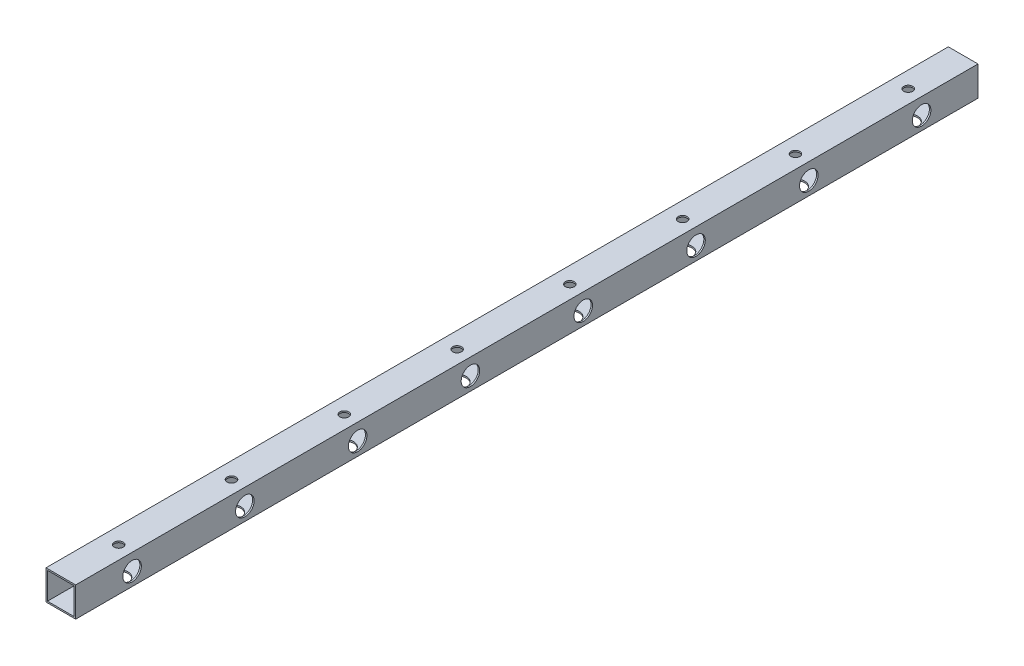
from build123d import *

# Parameters (mm, degrees)
SKETCH1_W           = 40
SKETCH1_H           = 40
SKETCH1_W_2         = 36
SKETCH1_H_2         = 36
EXTRUDE_THIN1_DEPTH = 1216
SKETCH4_R           = 12.5
CUT_EXTRUDE2_DEPTH  = 10
SKETCH5_R           = 12.5
CUT_EXTRUDE3_DEPTH  = 10
SKETCH6_R           = 6
CUT_EXTRUDE4_DEPTH  = 10
SKETCH7_R           = 6
CUT_EXTRUDE5_DEPTH  = 10
LPATTERN2_COUNT     = 8
LPATTERN2_PITCH     = 152


with BuildPart() as part:
    # Sketch1 → Extrude-Thin1 (new body)
    with BuildSketch(Plane.XY):
        Rectangle(SKETCH1_W, SKETCH1_H)
        Rectangle(SKETCH1_W_2, SKETCH1_H_2, mode=Mode.SUBTRACT)
    extrude(amount=EXTRUDE_THIN1_DEPTH)

    # Sketch4 → Cut-Extrude2 (cut)
    with BuildSketch(Plane(origin=(20, 0, 0), x_dir=(0, 0, -1), z_dir=(1, 0, 0))):
        with Locations((-1140, -2)):
            Circle(SKETCH4_R)
    cut_extrude2 = extrude(amount=-CUT_EXTRUDE2_DEPTH, mode=Mode.SUBTRACT)

    # Sketch5 → Cut-Extrude3 (cut)
    with BuildSketch(Plane.XZ.offset(20)):
        with Locations((2, 1140)):
            Circle(SKETCH5_R)
    cut_extrude3 = extrude(amount=-CUT_EXTRUDE3_DEPTH, mode=Mode.SUBTRACT)

    # Sketch6 → Cut-Extrude4 (cut)
    with BuildSketch(Plane(origin=(-18, 0, 0), x_dir=(0, 0, -1), z_dir=(1, 0, 0))):
        with Locations((-1140, -2)):
            Circle(SKETCH6_R)
    cut_extrude4 = extrude(amount=-CUT_EXTRUDE4_DEPTH, mode=Mode.SUBTRACT)

    # Sketch7 → Cut-Extrude5 (cut)
    with BuildSketch(Plane(origin=(0, 20, 0), x_dir=(1, 0, 0), z_dir=(0, 1, 0))):
        with Locations((2, -1140)):
            Circle(SKETCH7_R)
    cut_extrude5 = extrude(amount=-CUT_EXTRUDE5_DEPTH, mode=Mode.SUBTRACT)

    # LPattern2: Cut-Extrude2, Cut-Extrude3, Cut-Extrude4, Cut-Extrude5 ×8
    with Locations(*[(0, 0, -i * LPATTERN2_PITCH) for i in range(1, LPATTERN2_COUNT)]):
        add(cut_extrude2, mode=Mode.SUBTRACT)
        add(cut_extrude3, mode=Mode.SUBTRACT)
        add(cut_extrude4, mode=Mode.SUBTRACT)
        add(cut_extrude5, mode=Mode.SUBTRACT)


solid = part.part
